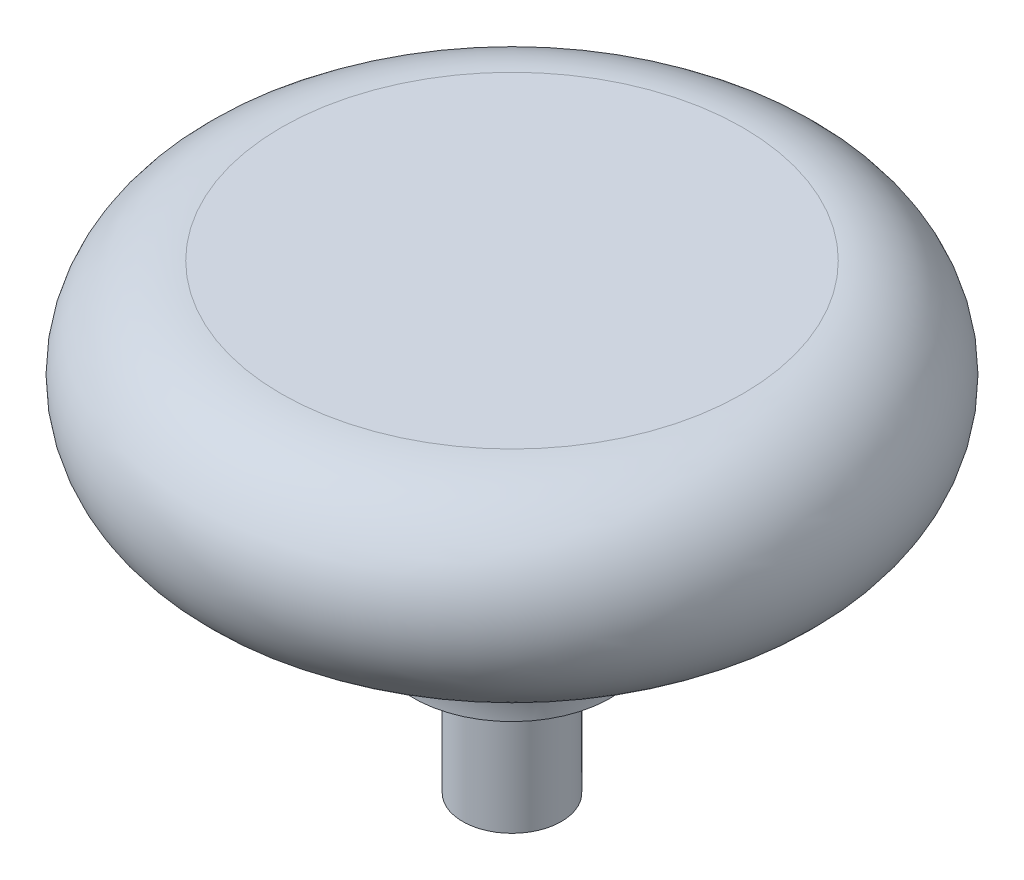
from build123d import *


with BuildPart() as part:
    # Sketch1 → Revolve2 (revolve)
    with BuildSketch(Plane.XY, mode=Mode.PRIVATE) as revolve2_sk:
        with BuildLine():
            Line((0, 4.76), (11.12, 4.76))
            ThreePointArc((11.12, 4.76), (15.879999879, -0.001071107), (11.117857786, -4.759999518))
            Line((11.117857786, -4.759999518), (9.449853088, -4.982210876))
            ThreePointArc((9.449853088, -4.982210876), (6.07038952, -7.253263843), (4.765, -11.11))
            Line((4.765, -11.11), (2.38, -11.11))
            Line((2.38, -11.11), (2.38, -17.46))
            Line((2.38, -17.46), (0, -17.46))
            Line((0, -17.46), (0, 4.76))
        make_face()
    revolve(revolve2_sk.sketch.rotate(Axis((0, 0, 0), (0, 1, 0)), 90), axis=Axis((0, 0, 0), (0, 1, 0)))


solid = part.part
